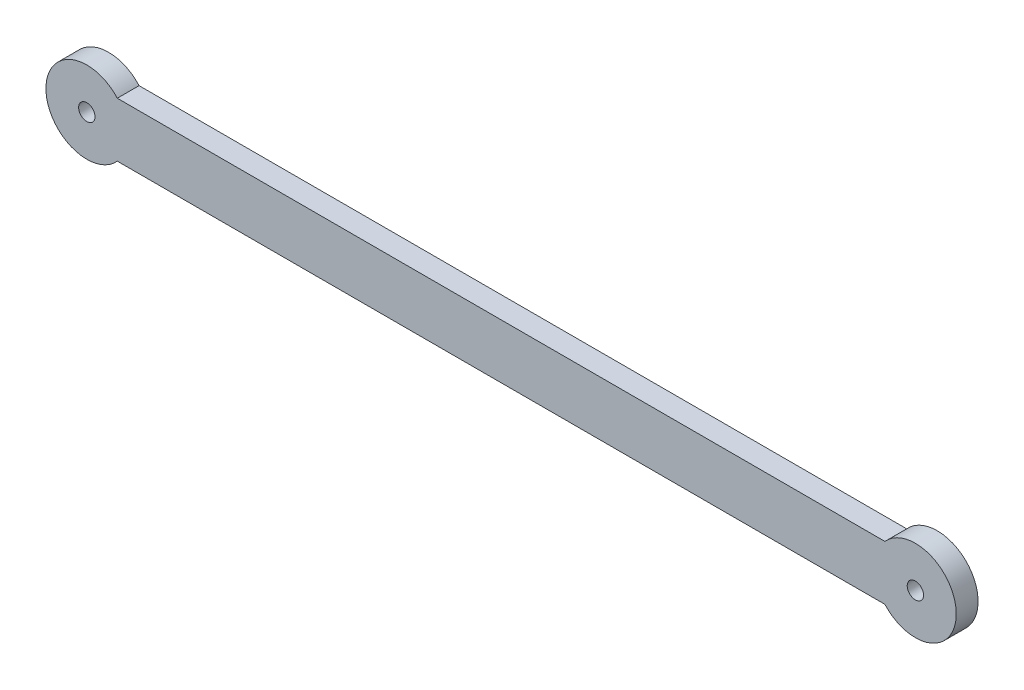
from build123d import *

# Parameters (mm, degrees)
SCHIZZO1_R                   = 1.5
ESTRUSIONE_ESTRUSIONE1_DEPTH = 4


with BuildPart() as part:
    # Schizzo1 → Estrusione-Estrusione1 (new body)
    with BuildSketch(Plane.XY):
        with BuildLine():
            Line((5.590169944, -5), (146.409830056, -5))
            ThreePointArc((146.409830056, -5), (159.5, 0), (146.409830056, 5))
            Line((146.409830056, 5), (5.590169944, 5))
            ThreePointArc((5.590169944, 5), (-7.5, 0), (5.590169944, -5))
        make_face()
        Circle(SCHIZZO1_R, mode=Mode.SUBTRACT)
        with Locations((152, 0)):
            Circle(SCHIZZO1_R, mode=Mode.SUBTRACT)
    extrude(amount=ESTRUSIONE_ESTRUSIONE1_DEPTH)


solid = part.part
